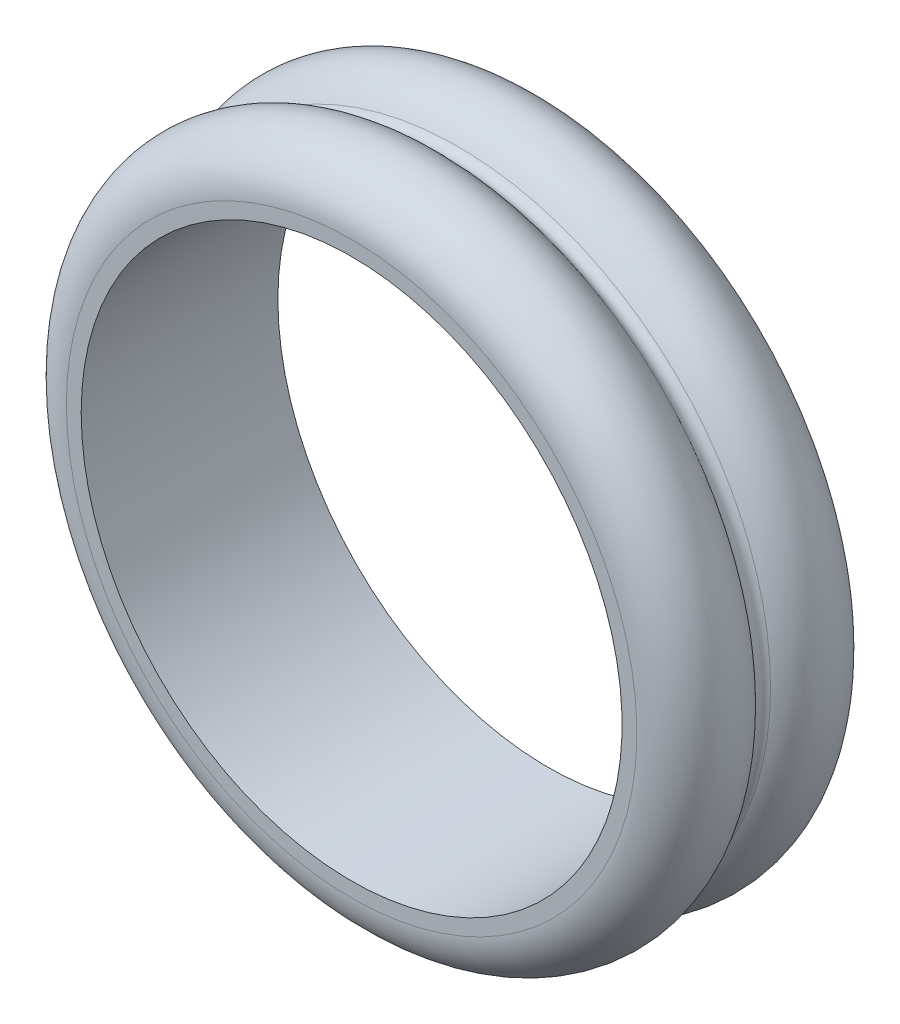
from build123d import *

# Parameters (mm, degrees)
SKETCH_2_R               = 5
EXTRUDE_1_DEPTH          = 10
PATTERN_CIRCULAR_1_COUNT = 6
EXTRUDE_2_DEPTH          = 7
SKETCH_4_R               = 1.4
CUT_EXTRUDE_1_DEPTH      = 50.325449958
PATTERN_CIRCULAR_2_COUNT = 6
SKETCH_5_R               = 5.5
EXTRUDE_3_DEPTH          = 5
SKETCH_7_R               = 7
CUT_EXTRUDE_3_DEPTH      = 1.5
CUT_EXTRUDE_3_DRAFT      = -40
SKETCH_8_R               = 1.5
CUT_EXTRUDE_4_DEPTH      = 51.222007264
SKETCH_10_R              = 1.25
CUT_EXTRUDE_6_DEPTH      = 51.675437971
PATTERN_CIRCULAR_3_COUNT = 6
SKETCH_11_R              = 2.5
CUT_EXTRUDE_7_DEPTH      = 51.675437971
PATTERN_CIRCULAR_4_COUNT = 2
CUT_EXTRUDE_8_DEPTH      = 8
PATTERN_CIRCULAR_5_COUNT = 6
CUT_EXTRUDE_9_DEPTH      = 8
SKETCH_14_R              = 27.5
CUT_EXTRUDE_11_DEPTH     = 55


with BuildPart() as part:
    # 草图1 → 旋转1 (revolve)
    with BuildSketch(Plane(origin=(0, 0, 0), x_dir=(1, 0, 0), z_dir=(0, 1, 0)), mode=Mode.PRIVATE) as revolve_1_sk:
        with BuildLine():
            Line((25, 10), (25, -10))
            Line((25, -10), (29, -10))
            ThreePointArc((29, -10), (33.787135539, -6.443375673), (31.763853992, -0.833333333))
            ThreePointArc((31.763853992, -0.833333333), (31.31662479, 0), (31.763853992, 0.833333333))
            ThreePointArc((31.763853992, 0.833333333), (33.787135539, 6.443375673), (29, 10))
            Line((29, 10), (25, 10))
        make_face()
    revolve(revolve_1_sk.sketch.rotate(Axis((0, 0, -146.934042126), (0, 0, 1)), 180), axis=Axis((0, 0, -146.934042126), (0, 0, 1)))

    # 草图2 → 凸台-拉伸1 (add)
    with BuildSketch(Plane.XY.offset(6)):
        with Locations((0, 21.5)):
            Circle(SKETCH_2_R)
    extrude_1 = extrude(amount=-EXTRUDE_1_DEPTH)

    # 阵列(圆周)1: 凸台-拉伸1 ×6 about axis
    pattern_circular_1_axis = Axis((0, 0, 0), (0, 0, 1))
    for i in range(1, PATTERN_CIRCULAR_1_COUNT):
        add(extrude_1.rotate(pattern_circular_1_axis, i * 360 / PATTERN_CIRCULAR_1_COUNT))

    # 草图3 → 凸台-拉伸2 (add)
    with BuildSketch(Plane.XY.offset(6)):
        with BuildLine():
            Line((-8.082903769, 0), (-10.874355653, -4.834936491))
            Line((-10.874355653, -4.834936491), (-15.051918724, -7.246853654))
            ThreePointArc((-15.051918724, -7.246853654), (-14.289419162, -8.25), (-13.801918724, -9.411917163))
            Line((-13.801918724, -9.411917163), (-9.624355653, -7))
            Line((-9.624355653, -7), (-4.041451884, -7))
            Line((-4.041451884, -7), (-1.25, -11.834936491))
            Line((-1.25, -11.834936491), (-1.25, -16.658770817))
            ThreePointArc((-1.25, -16.658770817), (0, -16.5), (1.25, -16.658770817))
            Line((1.25, -16.658770817), (1.25, -11.834936491))
            Line((1.25, -11.834936491), (4.041451884, -7))
            Line((4.041451884, -7), (9.624355653, -7))
            Line((9.624355653, -7), (13.801918724, -9.411917163))
            ThreePointArc((13.801918724, -9.411917163), (14.289419162, -8.25), (15.051918724, -7.246853654))
            Line((15.051918724, -7.246853654), (10.874355653, -4.834936491))
            Line((10.874355653, -4.834936491), (8.082903769, 0))
            Line((8.082903769, 0), (10.874355653, 4.834936491))
            Line((10.874355653, 4.834936491), (15.051918724, 7.246853654))
            ThreePointArc((15.051918724, 7.246853654), (14.289419162, 8.25), (13.801918724, 9.411917163))
            Line((13.801918724, 9.411917163), (9.624355653, 7))
            Line((9.624355653, 7), (4.041451884, 7))
            Line((4.041451884, 7), (1.25, 11.834936491))
            Line((1.25, 11.834936491), (1.25, 16.658770817))
            ThreePointArc((1.25, 16.658770817), (0, 16.5), (-1.25, 16.658770817))
            Line((-1.25, 16.658770817), (-1.25, 11.834936491))
            Line((-1.25, 11.834936491), (-4.041451884, 7))
            Line((-4.041451884, 7), (-9.624355653, 7))
            Line((-9.624355653, 7), (-13.801918724, 9.411917163))
            ThreePointArc((-13.801918724, 9.411917163), (-14.289419162, 8.25), (-15.051918724, 7.246853654))
            Line((-15.051918724, 7.246853654), (-10.874355653, 4.834936491))
            Line((-10.874355653, 4.834936491), (-8.082903769, 0))
        make_face()
    extrude(amount=-EXTRUDE_2_DEPTH)

    # 草图4 → 切除-拉伸1 (cut, through all)
    with BuildSketch(Plane(origin=(0, 0, -1), x_dir=(-1, 0, 0), z_dir=(0, 0, -1))):
        with Locations((0, 8.5)):
            Circle(SKETCH_4_R)
    cut_extrude_1 = extrude(amount=-CUT_EXTRUDE_1_DEPTH, mode=Mode.SUBTRACT)

    # 阵列(圆周)2: 切除-拉伸1 ×6 about axis
    pattern_circular_2_axis = Axis((0, 0, 0), (0, 0, 1))
    for i in range(1, PATTERN_CIRCULAR_2_COUNT):
        add(cut_extrude_1.rotate(pattern_circular_2_axis, i * 360 / PATTERN_CIRCULAR_2_COUNT), mode=Mode.SUBTRACT)

    # 草图5 → 凸台-拉伸3 (add)
    with BuildSketch(Plane(origin=(0, 0, -1), x_dir=(-1, 0, 0), z_dir=(0, 0, -1))):
        with Locations(Location((0, 0, 0), (0, 0, 180))):
            Circle(SKETCH_5_R)
    extrude(amount=EXTRUDE_3_DEPTH)


with BuildPart() as cut_extrude_3_tool:
    # 草图7 → 切除-拉伸3 (with draft: the straight prism first)
    with BuildSketch(Plane.XY.offset(6)):
        Circle(SKETCH_7_R)
    extrude(amount=-CUT_EXTRUDE_3_DEPTH)
    # 切除-拉伸3: the draft: its side faces are tilted about the plane it starts from
    cut_extrude_3_sides = [cut_extrude_3_tool.faces().sort_by_distance(p)[0] for p in [
        (-7, 0, 5.25),
    ]]
    draft(cut_extrude_3_sides, Plane.XY.offset(6), CUT_EXTRUDE_3_DRAFT)


with BuildPart() as part_1:
    add(part.part)

    # 切除-拉伸3: cut by cut_extrude_3_tool
    add(cut_extrude_3_tool.part, mode=Mode.SUBTRACT)

    # 草图8 → 切除-拉伸4 (cut, through all)
    with BuildSketch(Plane.XY.offset(4.5)):
        Circle(SKETCH_8_R)
    extrude(amount=-CUT_EXTRUDE_4_DEPTH, mode=Mode.SUBTRACT)

    # 草图10 → 切除-拉伸6 (cut, through all)
    with BuildSketch(Plane.XY.offset(6)):
        with Locations((0, 21.5)):
            Circle(SKETCH_10_R)
    cut_extrude_6 = extrude(amount=-CUT_EXTRUDE_6_DEPTH, mode=Mode.SUBTRACT)

    # 阵列(圆周)3: 切除-拉伸6 ×6 about axis
    pattern_circular_3_axis = Axis((0, 0, 0), (0, 0, 1))
    for i in range(1, PATTERN_CIRCULAR_3_COUNT):
        add(cut_extrude_6.rotate(pattern_circular_3_axis, i * 360 / PATTERN_CIRCULAR_3_COUNT), mode=Mode.SUBTRACT)

    # 草图11 → 切除-拉伸7 (cut, through all)
    with BuildSketch(Plane.XY.offset(6)):
        with Locations((0, 21.5)):
            Circle(SKETCH_11_R)
    cut_extrude_7 = extrude(amount=-CUT_EXTRUDE_7_DEPTH, mode=Mode.SUBTRACT)

    # 阵列(圆周)4: 切除-拉伸7 ×2 about axis
    pattern_circular_4_axis = Axis((0, 0, 0), (0, 0, 1))
    for i in range(1, PATTERN_CIRCULAR_4_COUNT):
        add(cut_extrude_7.rotate(pattern_circular_4_axis, i * 360 / PATTERN_CIRCULAR_4_COUNT), mode=Mode.SUBTRACT)

    # 草图12 → 切除-拉伸8 (cut)
    with BuildSketch(Plane.XY.offset(6)):
        Polygon((20.062921854, 8.25), (21.506297527, 10.75), (20.062921854, 13.25), (17.176170508, 13.25), (15.732794835, 10.75), (17.176170508, 8.25), align=None)
    cut_extrude_8 = extrude(amount=-CUT_EXTRUDE_8_DEPTH, mode=Mode.SUBTRACT)

    # 阵列(圆周)5: 切除-拉伸8 ×6 about axis, 2 skipped
    pattern_circular_5_axis = Axis((0, 0, 0), (0, 0, -1))
    add([cut_extrude_8.rotate(pattern_circular_5_axis, i * 360 / PATTERN_CIRCULAR_5_COUNT) for i in range(1, PATTERN_CIRCULAR_5_COUNT) if i not in (2, 5)], mode=Mode.SUBTRACT)

    # 草图9 → 切除-拉伸9 (cut)
    with BuildSketch(Plane(origin=(0, 0, -6), x_dir=(-1, 0, 0), z_dir=(0, 0, -1))):
        Polygon((3.5, 0), (1.75, 3.031088913), (-1.75, 3.031088913), (-3.5, 0), (-1.75, -3.031088913), (1.75, -3.031088913), align=None)
    extrude(amount=-CUT_EXTRUDE_9_DEPTH, mode=Mode.SUBTRACT)

    # 草图14 → 切除-拉伸11 (cut)
    with BuildSketch(Plane(origin=(0, 0, -10), x_dir=(-1, 0, 0), z_dir=(0, 0, -1))):
        Circle(SKETCH_14_R)
    extrude(amount=-CUT_EXTRUDE_11_DEPTH, mode=Mode.SUBTRACT)


solid = part_1.part
